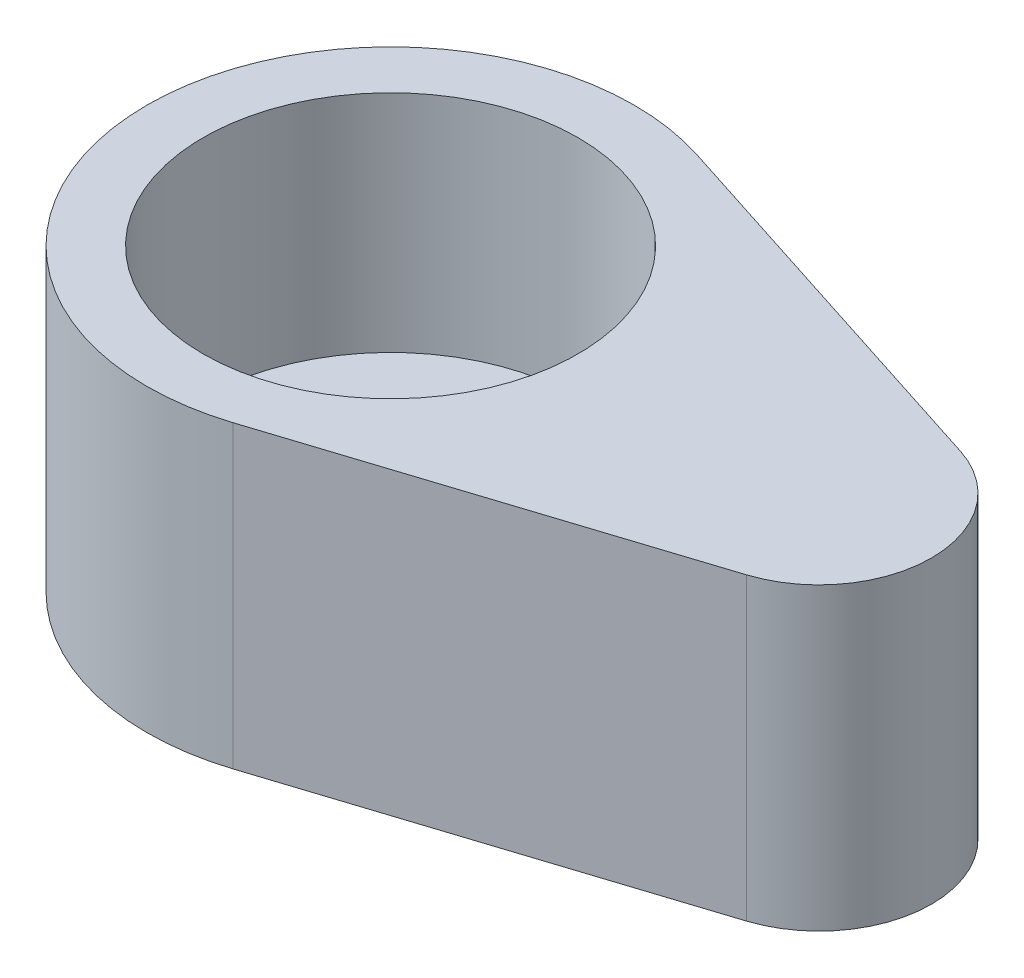
from build123d import *

# Parameters (mm, degrees)
SKETCH1_R           = 6.5
BOSS_EXTRUDE1_DEPTH = 8.000000002
SKETCH2_R           = 5
CUT_EXTRUDE1_DEPTH  = 5.999999938


with BuildPart() as part:
    # Sketch1 → Boss-Extrude1 (new body)
    with BuildSketch(Plane(origin=(0, 0, 0), x_dir=(1, 0, 0), z_dir=(0, 1, 0))):
        Circle(SKETCH1_R)
        with BuildLine():
            ThreePointArc((6.5, 0), (5.252972745, -3.828351779), (1.990376203, -6.187762323))
            Line((1.990376203, -6.187762323), (12.348635171, -2.855890303))
            ThreePointArc((12.348635171, -2.855890303), (14.43, 0), (12.348635171, 2.855890303))
            Line((12.348635171, 2.855890303), (1.990376203, 6.187762323))
            ThreePointArc((1.990376203, 6.187762323), (5.252972745, 3.828351779), (6.5, 0))
        make_face()
    extrude(amount=BOSS_EXTRUDE1_DEPTH)

    # Sketch2 → Cut-Extrude1 (cut)
    with BuildSketch(Plane(origin=(0, 8.000000002, 0), x_dir=(1, 0, 0), z_dir=(0, 1, 0))):
        with Locations(Location((0, 0, 0), (0, 0, 270))):
            Circle(SKETCH2_R)
    extrude(amount=-CUT_EXTRUDE1_DEPTH, mode=Mode.SUBTRACT)


solid = part.part
